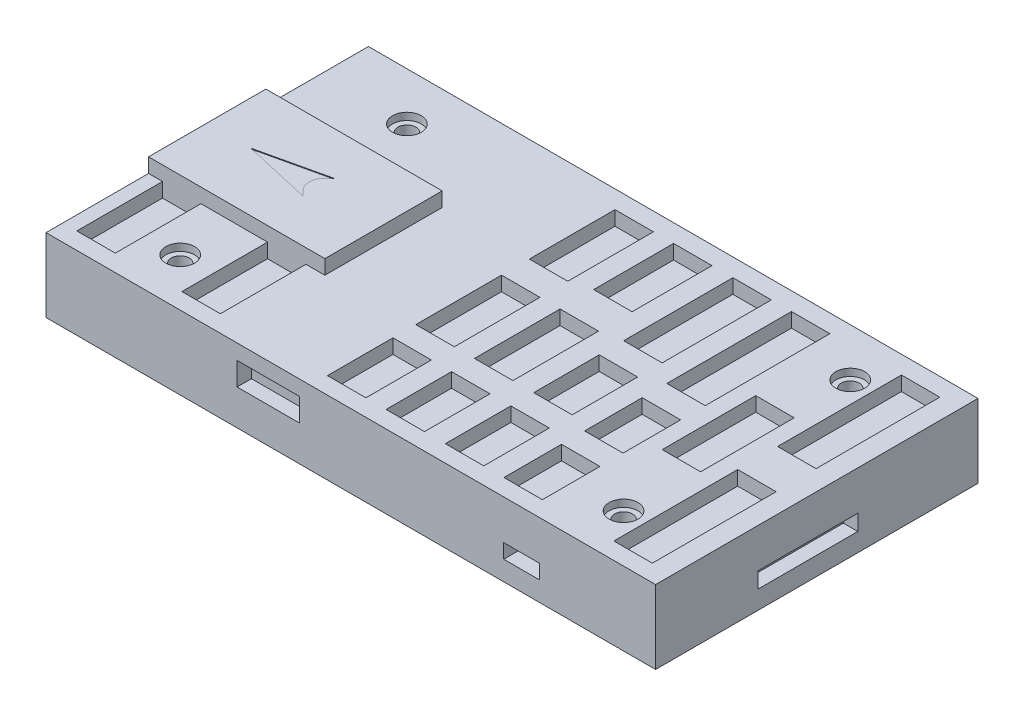
from build123d import *

# Parameters (mm, degrees)
SKETCH1_W           = 84.7
SKETCH1_H           = 44.8
BOSS_EXTRUDE1_DEPTH = 10.22
SKETCH2_W           = 24.5
SKETCH2_H           = 16.3
BOSS_EXTRUDE2_DEPTH = 2
SKETCH3_W           = 5.34
SKETCH3_H           = 9.1
SKETCH3_H_2         = 11.9
SKETCH3_H_3         = 11.1
SKETCH3_H_4         = 15.17
SKETCH3_H_5         = 17.32
SKETCH3_H_6         = 8
SKETCH3_H_7         = 13
SKETCH3_H_8         = 17.2
CUT_EXTRUDE1_DEPTH  = 2
SKETCH4_R           = 1.25
CUT_EXTRUDE2_DEPTH  = 50.443006583
SKETCH5_R           = 2
CUT_EXTRUDE3_DEPTH  = 1
SKETCH7_W           = 8.64
SKETCH7_H           = 3.2
CUT_EXTRUDE5_DEPTH  = 2
SKETCH8_W           = 5
SKETCH8_H           = 2
CUT_EXTRUDE6_DEPTH  = 2
SKETCH9_W           = 20.33
SKETCH9_H           = 3.1
SKETCH9_W_2         = 5.5
SKETCH9_H_2         = 2
CUT_EXTRUDE7_DEPTH  = 2
SKETCH10_W          = 13.9
SKETCH10_H          = 2.2
CUT_EXTRUDE8_DEPTH  = 2
CUT_EXTRUDE9_DEPTH  = 0.1


with BuildPart() as part:
    # Sketch1 → Boss-Extrude1 (new body)
    with BuildSketch(Plane(origin=(0, 0, 0), x_dir=(1, 0, 0), z_dir=(0, 1, 0))):
        Rectangle(SKETCH1_W, SKETCH1_H)
    extrude(amount=BOSS_EXTRUDE1_DEPTH)

    # Sketch2 → Boss-Extrude2 (add)
    with BuildSketch(Plane(origin=(0, 10.22, 0), x_dir=(1, 0, 0), z_dir=(0, 1, 0))):
        with Locations((-30.1, 0)):
            Rectangle(SKETCH2_W, SKETCH2_H)
    extrude(amount=BOSS_EXTRUDE2_DEPTH)

    # Sketch3 → Cut-Extrude1 (cut)
    with BuildSketch(Plane(origin=(0, 10.22, 0), x_dir=(1, 0, 0), z_dir=(0, 1, 0))):
        with Locations((-2.92, -15.5)):
            Rectangle(SKETCH3_W, SKETCH3_H)
        with Locations((-2.92, -1.82)):
            Rectangle(SKETCH3_W, SKETCH3_H_2)
        with Locations((-2.92, 13.95)):
            Rectangle(SKETCH3_W, SKETCH3_H_2)
        with Locations((5.22, 14.35)):
            Rectangle(SKETCH3_W, SKETCH3_H_3)
        with Locations((5.22, -1.82)):
            Rectangle(SKETCH3_W, SKETCH3_H_2)
        with Locations((5.22, -15.5)):
            Rectangle(SKETCH3_W, SKETCH3_H)
        with Locations((13.46, -15.5)):
            Rectangle(SKETCH3_W, SKETCH3_H)
        with Locations((13.46, -3.22)):
            Rectangle(SKETCH3_W, SKETCH3_H)
        with Locations((13.46, 12.315)):
            Rectangle(SKETCH3_W, SKETCH3_H_4)
        with Locations((21.6, 11.24)):
            Rectangle(SKETCH3_W, SKETCH3_H_5)
        with Locations((21.6, -4.84)):
            Rectangle(SKETCH3_W, SKETCH3_H_6)
        with Locations((21.6, -16.05)):
            Rectangle(SKETCH3_W, SKETCH3_H_6)
        with Locations((29.24, 0.8)):
            Rectangle(SKETCH3_W, SKETCH3_H_7)
        with Locations((36.88, 11.3)):
            Rectangle(SKETCH3_W, SKETCH3_H_8)
        with Locations((36.88, -11.45)):
            Rectangle(SKETCH3_W, SKETCH3_H_8)
        with Locations((-37.74, -14.1)):
            Rectangle(SKETCH3_W, SKETCH3_H_2)
        with Locations((-23.15, -14.1)):
            Rectangle(SKETCH3_W, SKETCH3_H_2)
    extrude(amount=-CUT_EXTRUDE1_DEPTH, mode=Mode.SUBTRACT)

    # Sketch4 → Cut-Extrude2 (cut, through all)
    with BuildSketch(Plane.XZ):
        with Locations(Location((-30.35, 15.75, 0), (0, 0, 270))):
            Circle(SKETCH4_R)
        with Locations(Location((-30.35, -15.75, 0), (0, 0, 270))):
            Circle(SKETCH4_R)
        with Locations(Location((31.25, 15.75, 0), (0, 0, 270))):
            Circle(SKETCH4_R)
        with Locations(Location((31.25, -15.75, 0), (0, 0, 270))):
            Circle(SKETCH4_R)
    extrude(amount=-CUT_EXTRUDE2_DEPTH, mode=Mode.SUBTRACT)

    # Sketch5 → Cut-Extrude3 (cut)
    with BuildSketch(Plane(origin=(0, 10.22, 0), x_dir=(1, 0, 0), z_dir=(0, 1, 0))):
        with Locations(Location((-30.35, -15.75, 0), (0, 0, 270))):
            Circle(SKETCH5_R)
        with Locations(Location((31.25, 15.75, 0), (0, 0, 270))):
            Circle(SKETCH5_R)
        with Locations(Location((31.25, -15.75, 0), (0, 0, 270))):
            Circle(SKETCH5_R)
        with Locations(Location((-30.35, 15.75, 0), (0, 0, 270))):
            Circle(SKETCH5_R)
    extrude(amount=-CUT_EXTRUDE3_DEPTH, mode=Mode.SUBTRACT)

    # Sketch7 → Cut-Extrude5 (cut)
    with BuildSketch(Plane.XY.offset(22.4)):
        with Locations((-11.48, 6.52)):
            Rectangle(SKETCH7_W, SKETCH7_H)
    extrude(amount=-CUT_EXTRUDE5_DEPTH, mode=Mode.SUBTRACT)

    # Sketch8 → Cut-Extrude6 (cut)
    with BuildSketch(Plane.XY.offset(22.4)):
        with Locations((23.75, 3.72)):
            Rectangle(SKETCH8_W, SKETCH8_H)
    extrude(amount=-CUT_EXTRUDE6_DEPTH, mode=Mode.SUBTRACT)

    # Sketch9 → Cut-Extrude7 (cut)
    with BuildSketch(Plane(origin=(0, 0, -22.4), x_dir=(-1, 0, 0), z_dir=(0, 0, -1))):
        with Locations((-2.885, 3.3)):
            Rectangle(SKETCH9_W, SKETCH9_H)
        with Locations((-23.2, 3.72)):
            Rectangle(SKETCH9_W_2, SKETCH9_H_2)
    extrude(amount=-CUT_EXTRUDE7_DEPTH, mode=Mode.SUBTRACT)

    # Sketch10 → Cut-Extrude8 (cut)
    with BuildSketch(Plane(origin=(42.35, 0, 0), x_dir=(0, 0, -1), z_dir=(1, 0, 0))):
        with Locations((-1.25, 3.66)):
            Rectangle(SKETCH10_W, SKETCH10_H)
    extrude(amount=-CUT_EXTRUDE8_DEPTH, mode=Mode.SUBTRACT)

    # Sketch11 → Cut-Extrude9 (cut)
    with BuildSketch(Plane(origin=(0, 12.22, 0), x_dir=(1, 0, 0), z_dir=(0, 1, 0))):
        with BuildLine():
            Line((-36.282417149, 0), (-26.882417149, 2.15))
            Line((-26.882417149, 2.15), (-27.617159632, 1.392199815))
            ThreePointArc((-27.617159632, 1.392199815), (-28.181269776, 0), (-27.617159632, -1.392199815))
            Line((-27.617159632, -1.392199815), (-26.882417149, -2.15))
            Line((-26.882417149, -2.15), (-36.282417149, 0))
        make_face()
    extrude(amount=-CUT_EXTRUDE9_DEPTH, mode=Mode.SUBTRACT)


solid = part.part
